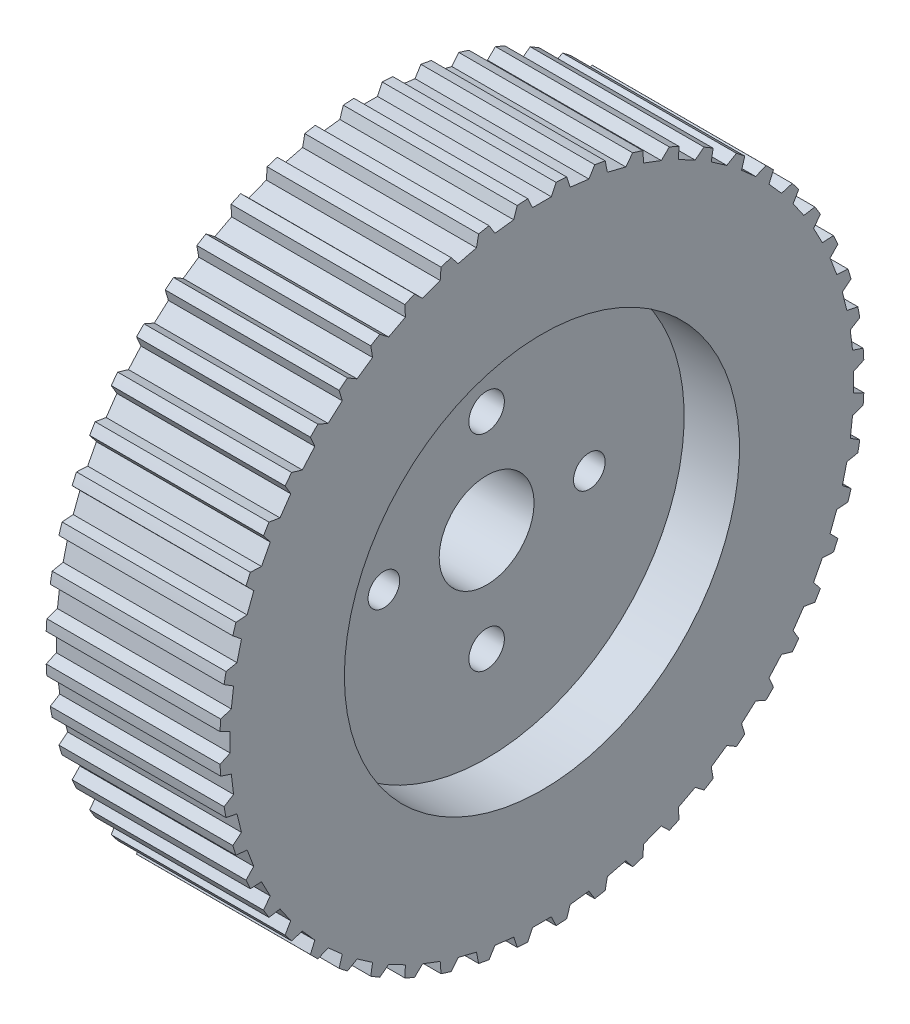
from build123d import *

# Parameters (mm, degrees)
ESQUISSE2_R                  = 2.25
ESQUISSE2_R_2                = 2
ENL_V_MAT_EXTRU_1_DEPTH      = 62.712120365
ENL_V_MAT_EXTRU_2_DEPTH      = 62.712120365
R_P_TITION_CIRCULAIRE1_COUNT = 52


with BuildPart() as part:
    # Esquisse1 → Révolution1 (revolve)
    with BuildSketch(Plane.XY, mode=Mode.PRIVATE) as r_volution1_sk:
        Polygon((0, 25), (7, 25), (7, 40.77), (-15, 40.77), (-15, 6), (0, 6), align=None)
    revolve(r_volution1_sk.sketch.rotate(Axis((-40.008180301, 0, 0), (1, 0, 0)), 90), axis=Axis((-40.008180301, 0, 0), (1, 0, 0)))

    # Esquisse2 → Enlèv. mat.-Extru.1 (cut, through all)
    with BuildSketch(Plane.ZY.offset(15)):
        with Locations((0, 13)):
            Circle(ESQUISSE2_R)
        with Locations((13, 0)):
            Circle(ESQUISSE2_R_2)
        with Locations((0, -13)):
            Circle(ESQUISSE2_R)
        with Locations((-13, 0)):
            Circle(ESQUISSE2_R_2)
    extrude(amount=-ENL_V_MAT_EXTRU_1_DEPTH, mode=Mode.SUBTRACT)

    # Esquisse3 → Enlèv. mat.-Extru.2 (cut, through all)
    with BuildSketch(Plane.ZY.offset(15)):
        Polygon((-2.15, 41.5), (-1.194069301, 39.45), (1.194069301, 39.45), (2.15, 41.5), align=None)
    enl_v_mat_extru_2 = extrude(amount=-ENL_V_MAT_EXTRU_2_DEPTH, mode=Mode.SUBTRACT)

    # Répétition circulaire1: Enlèv. mat.-Extru.2 ×52 about axis
    r_p_tition_circulaire1_axis = Axis((0, 0, 0), (1, 0, 0))
    for i in range(1, R_P_TITION_CIRCULAIRE1_COUNT):
        add(enl_v_mat_extru_2.rotate(r_p_tition_circulaire1_axis, i * 360 / R_P_TITION_CIRCULAIRE1_COUNT), mode=Mode.SUBTRACT)


solid = part.part
